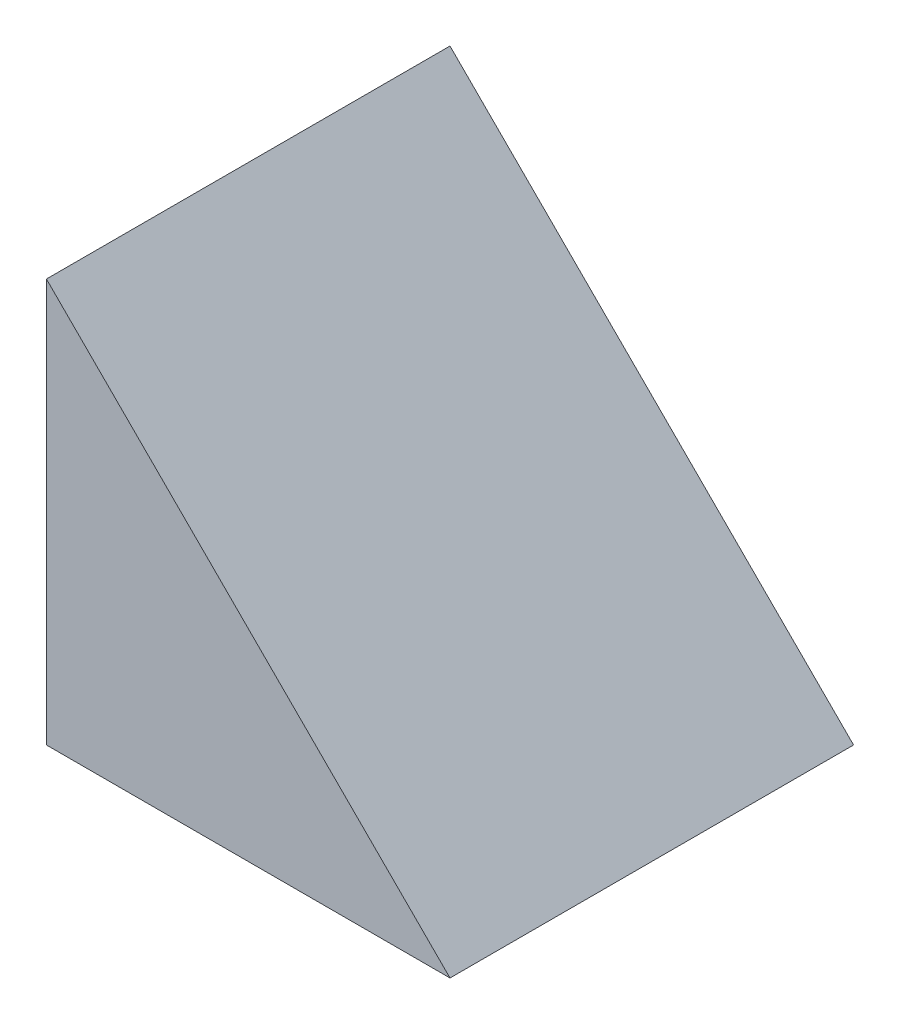
from build123d import *

# Parameters (mm, degrees)
EXTRUDE_1_DEPTH = 50


with BuildPart() as part:
    # 草图1 → 凸台-拉伸1 (new, symmetric)
    with BuildSketch(Plane.XY):
        Polygon((-30.42560832, 46.96969697), (-30.42560832, -53.03030303), (69.57439168, -53.03030303), align=None)
    extrude(amount=EXTRUDE_1_DEPTH, both=True)


solid = part.part
